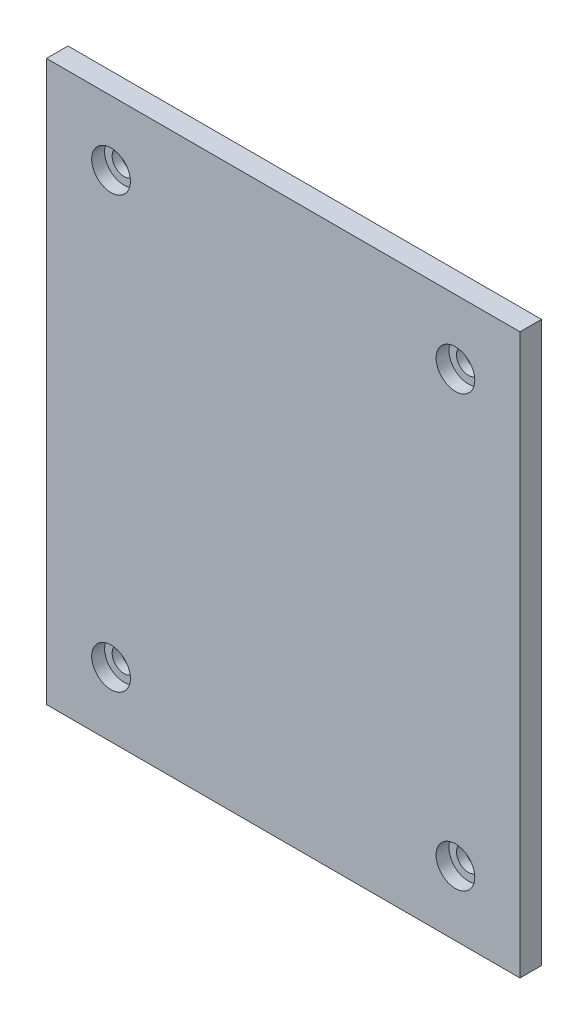
from build123d import *

# Parameters (mm, degrees)
SKETCH1_W           = 130
SKETCH1_H           = 110
BOSS_EXTRUDE1_DEPTH = 5
SKETCH3_R           = 2.75
CUT_EXTRUDE1_DEPTH  = 86.293610546
SKETCH4_R           = 4.5
CUT_EXTRUDE2_DEPTH  = 3


with BuildPart() as part:
    # Sketch1 → Boss-Extrude1 (new body)
    with BuildSketch(Plane(origin=(0, 0, 0), x_dir=(0, 1, 0), z_dir=(0, 0, 1))):
        Rectangle(SKETCH1_W, SKETCH1_H)
    extrude(amount=BOSS_EXTRUDE1_DEPTH)

    # Sketch3 → Cut-Extrude1 (cut, through all)
    with BuildSketch(Plane.XY.offset(5)):
        with Locations((-40, 50)):
            Circle(SKETCH3_R)
        with Locations((40, -50)):
            Circle(SKETCH3_R)
        with Locations((-40, -50)):
            Circle(SKETCH3_R)
        with Locations((40, 50)):
            Circle(SKETCH3_R)
    extrude(amount=-CUT_EXTRUDE1_DEPTH, mode=Mode.SUBTRACT)

    # Sketch4 → Cut-Extrude2 (cut)
    with BuildSketch(Plane.XY.offset(5)):
        with Locations((-40, 50)):
            Circle(SKETCH4_R)
        with Locations((40, 50)):
            Circle(SKETCH4_R)
        with Locations((40, -50)):
            Circle(SKETCH4_R)
        with Locations((-40, -50)):
            Circle(SKETCH4_R)
    extrude(amount=-CUT_EXTRUDE2_DEPTH, mode=Mode.SUBTRACT)


solid = part.part
